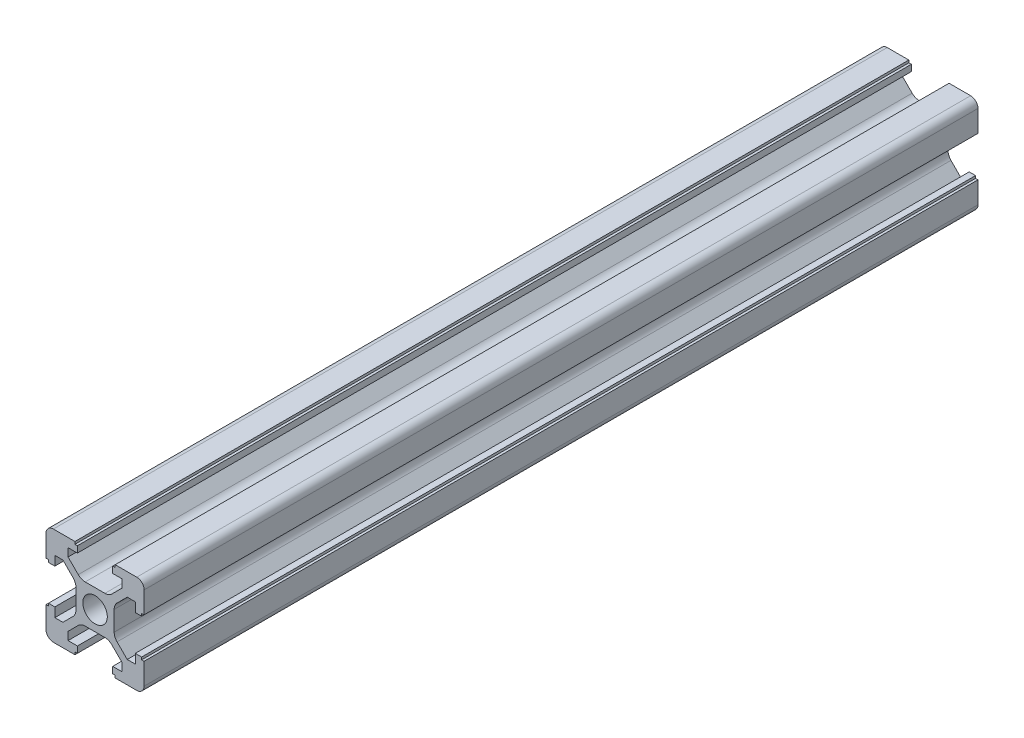
from build123d import *

# Parameters (mm, degrees)
SKETCH1_R           = 2.5
BOSS_EXTRUDE2_DEPTH = 170


with BuildPart() as part:
    # Sketch1 → Boss-Extrude2 (new body)
    with BuildSketch(Plane.XY):
        with BuildLine():
            Line((10, -4.1), (10, -8.5))
            ThreePointArc((10, -8.5), (9.560660172, -9.560660172), (8.5, -10))
            Line((8.5, -10), (4.1, -10))
            Line((4.1, -10), (4.1, -9.5))
            Line((4.1, -9.5), (3.6, -9.5))
            Line((3.6, -9.5), (3.6, -8.2))
            Line((3.6, -8.2), (5.5, -8.2))
            Line((5.5, -8.2), (5.5, -6.560660172))
            Line((5.5, -6.560660172), (3.425126266, -4.485786438))
            ThreePointArc((3.425126266, -4.485786438), (2.776279568, -4.052240935), (2.010912703, -3.9))
            Line((2.010912703, -3.9), (-2.010912703, -3.9))
            ThreePointArc((-2.010912703, -3.9), (-2.776279568, -4.052240935), (-3.425126266, -4.485786438))
            Line((-3.425126266, -4.485786438), (-5.5, -6.560660172))
            Line((-5.5, -6.560660172), (-5.5, -8.2))
            Line((-5.5, -8.2), (-3.6, -8.2))
            Line((-3.6, -8.2), (-3.6, -9.5))
            Line((-3.6, -9.5), (-4.1, -9.5))
            Line((-4.1, -9.5), (-4.1, -10))
            Line((-4.1, -10), (-8.5, -10))
            ThreePointArc((-8.5, -10), (-9.560660172, -9.560660172), (-10, -8.5))
            Line((-10, -8.5), (-10, -4.1))
            Line((-10, -4.1), (-9.5, -4.1))
            Line((-9.5, -4.1), (-9.5, -3.6))
            Line((-9.5, -3.6), (-8.2, -3.6))
            Line((-8.2, -3.6), (-8.2, -5.5))
            Line((-8.2, -5.5), (-6.560660172, -5.5))
            Line((-6.560660172, -5.5), (-4.485786438, -3.425126266))
            ThreePointArc((-4.485786438, -3.425126266), (-4.052240935, -2.776279568), (-3.9, -2.010912703))
            Line((-3.9, -2.010912703), (-3.9, 2.010912703))
            ThreePointArc((-3.9, 2.010912703), (-4.052240935, 2.776279568), (-4.485786438, 3.425126266))
            Line((-4.485786438, 3.425126266), (-6.560660172, 5.5))
            Line((-6.560660172, 5.5), (-8.2, 5.5))
            Line((-8.2, 5.5), (-8.2, 3.6))
            Line((-8.2, 3.6), (-9.5, 3.6))
            Line((-9.5, 3.6), (-9.5, 4.1))
            Line((-9.5, 4.1), (-10, 4.1))
            Line((-10, 4.1), (-10, 8.5))
            ThreePointArc((-10, 8.5), (-9.560660172, 9.560660172), (-8.5, 10))
            Line((-8.5, 10), (-4.1, 10))
            Line((-4.1, 10), (-4.1, 9.5))
            Line((-4.1, 9.5), (-3.6, 9.5))
            Line((-3.6, 9.5), (-3.6, 8.2))
            Line((-3.6, 8.2), (-5.5, 8.2))
            Line((-5.5, 8.2), (-5.5, 6.560660172))
            Line((-5.5, 6.560660172), (-3.425126266, 4.485786438))
            ThreePointArc((-3.425126266, 4.485786438), (-2.776279568, 4.052240935), (-2.010912703, 3.9))
            Line((-2.010912703, 3.9), (2.010912703, 3.9))
            ThreePointArc((2.010912703, 3.9), (2.776279568, 4.052240935), (3.425126266, 4.485786438))
            Line((3.425126266, 4.485786438), (5.5, 6.560660172))
            Line((5.5, 6.560660172), (5.5, 8.2))
            Line((5.5, 8.2), (3.6, 8.2))
            Line((3.6, 8.2), (3.6, 9.5))
            Line((3.6, 9.5), (4.1, 9.5))
            Line((4.1, 9.5), (4.1, 10))
            Line((4.1, 10), (8.5, 10))
            ThreePointArc((8.5, 10), (9.560660172, 9.560660172), (10, 8.5))
            Line((10, 8.5), (10, 4.1))
            Line((10, 4.1), (9.5, 4.1))
            Line((9.5, 4.1), (9.5, 3.6))
            Line((9.5, 3.6), (8.2, 3.6))
            Line((8.2, 3.6), (8.2, 5.5))
            Line((8.2, 5.5), (6.560660172, 5.5))
            Line((6.560660172, 5.5), (4.485786438, 3.425126266))
            ThreePointArc((4.485786438, 3.425126266), (4.052240935, 2.776279568), (3.9, 2.010912703))
            Line((3.9, 2.010912703), (3.9, -2.010912703))
            ThreePointArc((3.9, -2.010912703), (4.052240935, -2.776279568), (4.485786438, -3.425126266))
            Line((4.485786438, -3.425126266), (6.560660172, -5.5))
            Line((6.560660172, -5.5), (8.2, -5.5))
            Line((8.2, -5.5), (8.2, -3.6))
            Line((8.2, -3.6), (9.5, -3.6))
            Line((9.5, -3.6), (9.5, -4.1))
            Line((9.5, -4.1), (10, -4.1))
        make_face()
        Circle(SKETCH1_R, mode=Mode.SUBTRACT)
    extrude(amount=BOSS_EXTRUDE2_DEPTH)


solid = part.part
